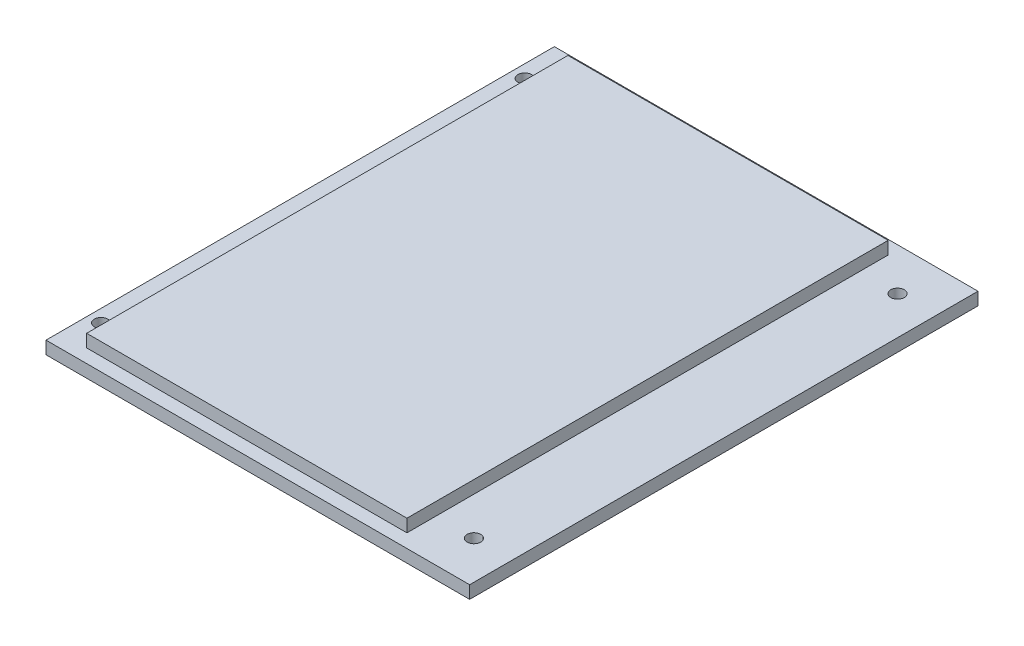
from build123d import *

# Parameters (mm, degrees)
SKETCH1_W           = 100
SKETCH1_H           = 120
BOSS_EXTRUDE1_DEPTH = 3
SKETCH2_W           = 75.6
SKETCH2_H           = 113.6
BOSS_EXTRUDE2_DEPTH = 3
SKETCH3_R           = 1.6
CUT_EXTRUDE1_DEPTH  = 79.160092119


with BuildPart() as part:
    # Sketch1 → Boss-Extrude1 (new body)
    with BuildSketch(Plane(origin=(0, 0, 0), x_dir=(1, 0, 0), z_dir=(0, 1, 0))):
        Rectangle(SKETCH1_W, SKETCH1_H)
    extrude(amount=BOSS_EXTRUDE1_DEPTH)

    # Sketch2 → Boss-Extrude2 (add)
    with BuildSketch(Plane(origin=(0, 3, 0), x_dir=(1, 0, 0), z_dir=(0, 1, 0))):
        with Locations((-5.8, 0)):
            Rectangle(SKETCH2_W, SKETCH2_H)
    extrude(amount=BOSS_EXTRUDE2_DEPTH)

    # Sketch3 → Cut-Extrude1 (cut, through all)
    with BuildSketch(Plane(origin=(0, 3, 0), x_dir=(1, 0, 0), z_dir=(0, 1, 0))):
        with Locations(Location((41, -50, 0), (0, 0, 270))):
            Circle(SKETCH3_R)
        with Locations(Location((41, 50, 0), (0, 0, 270))):
            Circle(SKETCH3_R)
        with Locations(Location((-47, -50, 0), (0, 0, 270))):
            Circle(SKETCH3_R)
        with Locations(Location((-47, 50, 0), (0, 0, 270))):
            Circle(SKETCH3_R)
    extrude(amount=-CUT_EXTRUDE1_DEPTH, mode=Mode.SUBTRACT)


solid = part.part
